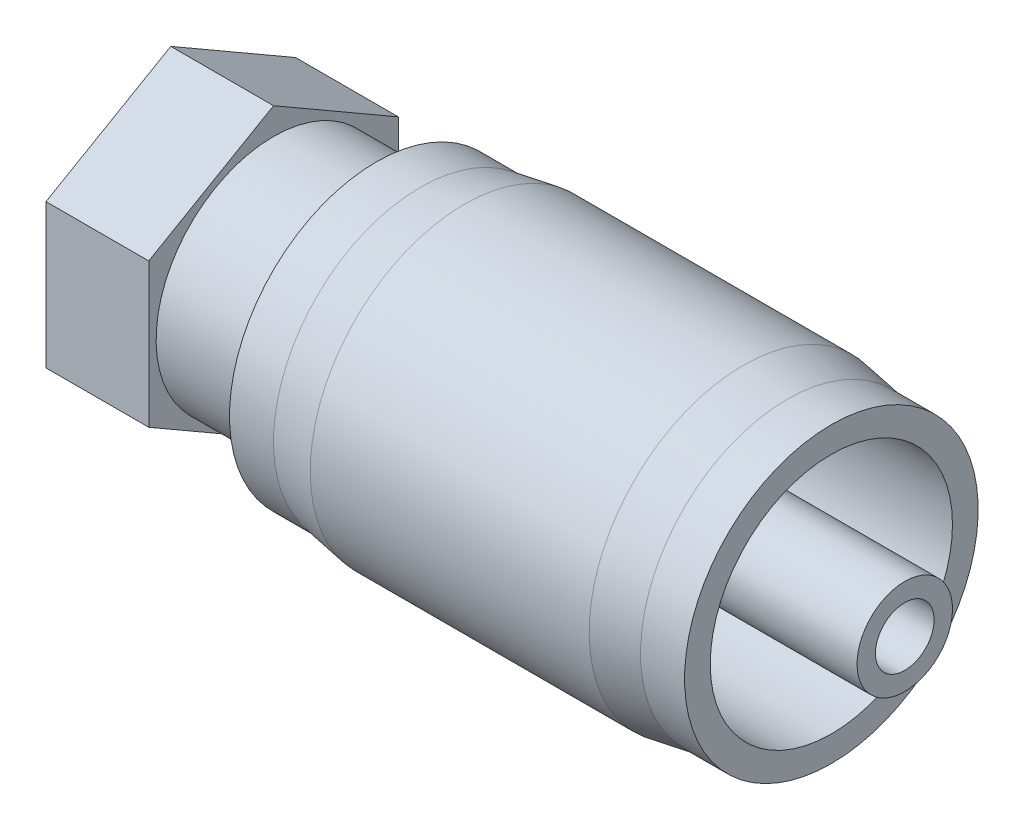
from build123d import *

# Parameters (mm, degrees)
SCHNITT_LINEAR_AUSTRAGEN1_REACH = 54.364
SKIZZE2_R                       = 11


with BuildPart() as part:
    # Skizze1 → Rotation3 (revolve)
    with BuildSketch(Plane.XY):
        Polygon((1, 2), (50, 2), (50, 3.25), (24, 3.25), (24, 8.25), (45, 8.25), (45, 10), (42, 10), (39, 10.5), (20, 10.5), (17, 10), (14, 10), (14, 5.75), (13, 5.75), (13, 8), (7, 8), (7, 11), (0, 11), (0, 5.25), (8, 5.25), (8, 4.5), (1, 4.5), align=None)
    revolve(axis=Axis((92.390187717, 0, 0), (-1, 0, 0)))

    # Skizze2 → Schnitt-Linear austragen1 (cut, up to next)
    with BuildSketch(Plane.ZY, mode=Mode.PRIVATE) as schnitt_linear_austragen1_sk1:
        Circle(SKIZZE2_R)
        Polygon((-8.5, -4.907477288), (0, -9.814954576), (8.5, -4.907477288), (8.5, 4.907477288), (0, 9.814954576), (-8.5, 4.907477288), align=None, mode=Mode.SUBTRACT)
    schnitt_linear_austragen1_tool1 = extrude(schnitt_linear_austragen1_sk1.sketch, amount=-SCHNITT_LINEAR_AUSTRAGEN1_REACH, mode=Mode.PRIVATE) & part.part
    add(schnitt_linear_austragen1_tool1.solids().sort_by_distance((0, 0, -10.688873))[0], mode=Mode.SUBTRACT)


solid = part.part
